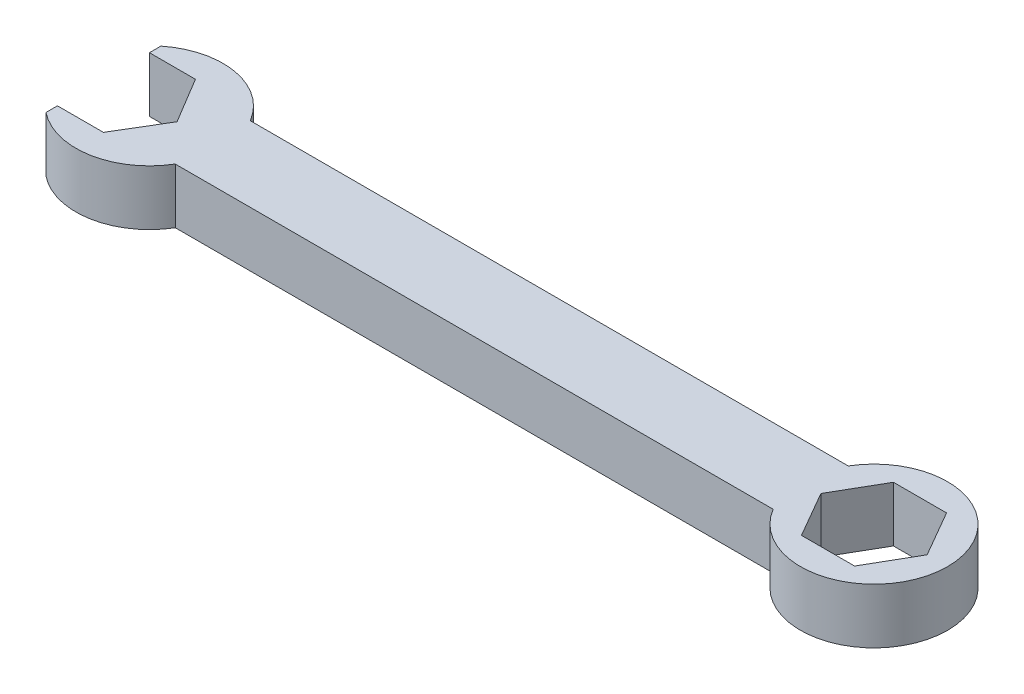
from build123d import *

# Parameters (mm, degrees)
BOSS_EXTRUDE1_DEPTH = 7.62


with BuildPart() as part:
    # Sketch2 → Boss-Extrude1 (new body)
    with BuildSketch(Plane(origin=(0, 0, 0), x_dir=(1, 0, 0), z_dir=(0, 1, 0))):
        with BuildLine():
            ThreePointArc((87.481333576, -5.178289999), (98.907220268, -9.79891701), (106.382667152, 0))
            Line((106.382667152, 0), (103.555015571, 0))
            Line((103.555015571, 0), (101.721928466, -3.175))
            Line((101.721928466, -3.175), (99.888841361, -6.35))
            Line((99.888841361, -6.35), (92.556492943, -6.35))
            Line((92.556492943, -6.35), (90.723405838, -3.175))
            Line((90.723405838, -3.175), (88.890318733, 0))
            Line((88.890318733, 0), (0, 0))
            Line((0, 0), (-3.81, -6.35))
            Line((-3.81, -6.35), (-10.16, -6.35))
            Line((-10.16, -6.35), (-10.16, -7.931147458))
            ThreePointArc((-10.16, -7.931147458), (-1.986767948, -9.995070029), (4.931333576, -5.178289999))
            Line((4.931333576, -5.178289999), (87.481333576, -5.178289999))
        make_face()
        with BuildLine():
            Line((87.481333576, 5.178289999), (4.931333576, 5.178289999))
            ThreePointArc((4.931333576, 5.178289999), (-1.986767948, 9.995070029), (-10.16, 7.931147458))
            Line((-10.16, 7.931147458), (-10.16, 6.35))
            Line((-10.16, 6.35), (-3.81, 6.35))
            Line((-3.81, 6.35), (0, 0))
            Line((0, 0), (88.890318733, 0))
            Line((88.890318733, 0), (92.556492943, 6.35))
            Line((92.556492943, 6.35), (99.888841361, 6.35))
            Line((99.888841361, 6.35), (103.555015571, 0))
            Line((103.555015571, 0), (106.382667152, 0))
            ThreePointArc((106.382667152, 0), (98.907220268, 9.79891701), (87.481333576, 5.178289999))
        make_face()
    extrude(amount=BOSS_EXTRUDE1_DEPTH)


solid = part.part
